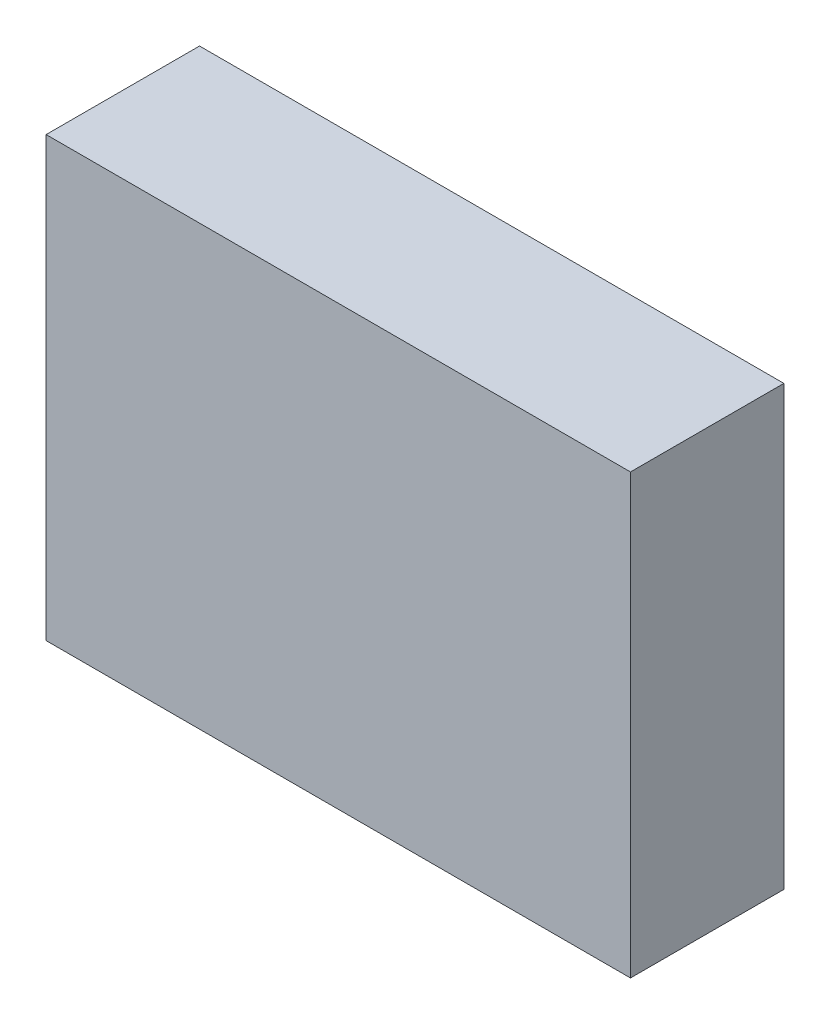
from build123d import *

# Parameters (mm, degrees)
SKETCH_1_W      = 80
SKETCH_1_H      = 60
EXTRUDE_1_DEPTH = 21


with BuildPart() as part:
    # 스케치1 → 보스-돌출1 (new body)
    with BuildSketch(Plane.XY):
        Rectangle(SKETCH_1_W, SKETCH_1_H)
    extrude(amount=EXTRUDE_1_DEPTH)


solid = part.part
